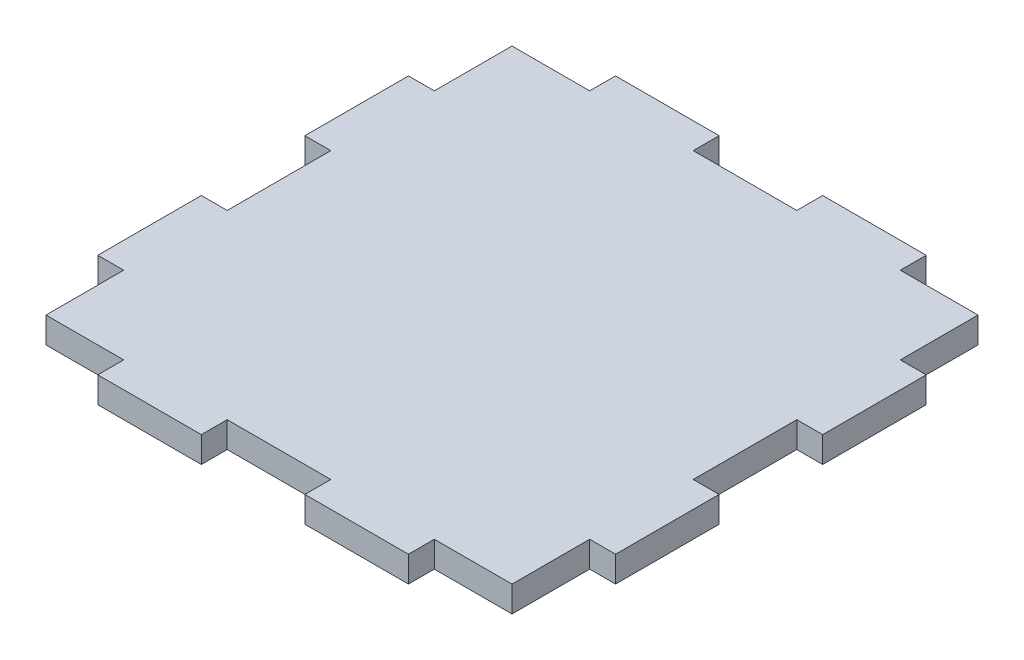
from build123d import *

# Parameters (mm, degrees)
SKETCH1_W           = 190.5
SKETCH1_H           = 190.5
BOSS_EXTRUDE1_DEPTH = 9.525
SKETCH2_W           = 9.525
SKETCH2_H           = 38.1
CUT_EXTRUDE1_DEPTH  = 9.525
SKETCH3_W           = 9.525
SKETCH3_H           = 38.1
CUT_EXTRUDE2_DEPTH  = 9.525
SKETCH4_W           = 9.525
SKETCH4_H           = 38.1
CUT_EXTRUDE3_DEPTH  = 9.525
SKETCH5_W           = 9.525
SKETCH5_H           = 38.1
CUT_EXTRUDE4_DEPTH  = 9.525
SKETCH6_W           = 9.525
SKETCH6_H           = 38.1
CUT_EXTRUDE5_DEPTH  = 9.525
SKETCH7_W           = 9.525
SKETCH7_H           = 38.1
CUT_EXTRUDE6_DEPTH  = 9.525
SKETCH8_W           = 28.575
SKETCH8_H           = 9.525
CUT_EXTRUDE7_DEPTH  = 9.525
SKETCH9_W           = 38.1
SKETCH9_H           = 9.525
CUT_EXTRUDE8_DEPTH  = 9.525
SKETCH10_W          = 28.575
SKETCH10_H          = 9.525
CUT_EXTRUDE9_DEPTH  = 9.525
SKETCH11_W          = 28.575
SKETCH11_H          = 9.525
CUT_EXTRUDE11_DEPTH = 9.525
SKETCH12_W          = 38.1
SKETCH12_H          = 9.525
CUT_EXTRUDE12_DEPTH = 9.525
SKETCH14_W          = 28.575
SKETCH14_H          = 9.525
CUT_EXTRUDE13_DEPTH = 9.525


with BuildPart() as part:
    # Sketch1 → Boss-Extrude1 (new body)
    with BuildSketch(Plane(origin=(0, 0, 0), x_dir=(1, 0, 0), z_dir=(0, 1, 0))):
        with Locations((-91.022160665, 92.07132964)):
            Rectangle(SKETCH1_W, SKETCH1_H)
    extrude(amount=BOSS_EXTRUDE1_DEPTH)

    # Sketch2 → Cut-Extrude1 (cut)
    with BuildSketch(Plane(origin=(0, 9.525, 0), x_dir=(1, 0, 0), z_dir=(0, 1, 0))):
        with Locations((-0.534660665, 15.87132964)):
            Rectangle(SKETCH2_W, SKETCH2_H)
    extrude(amount=-CUT_EXTRUDE1_DEPTH, mode=Mode.SUBTRACT)

    # Sketch3 → Cut-Extrude2 (cut)
    with BuildSketch(Plane(origin=(0, 9.525, 0), x_dir=(1, 0, 0), z_dir=(0, 1, 0))):
        with Locations((-0.534660665, 92.07132964)):
            Rectangle(SKETCH3_W, SKETCH3_H)
    extrude(amount=-CUT_EXTRUDE2_DEPTH, mode=Mode.SUBTRACT)

    # Sketch4 → Cut-Extrude3 (cut)
    with BuildSketch(Plane(origin=(0, 9.525, 0), x_dir=(1, 0, 0), z_dir=(0, 1, 0))):
        with Locations((-0.534660665, 168.27132964)):
            Rectangle(SKETCH4_W, SKETCH4_H)
    extrude(amount=-CUT_EXTRUDE3_DEPTH, mode=Mode.SUBTRACT)

    # Sketch5 → Cut-Extrude4 (cut)
    with BuildSketch(Plane.XZ):
        with Locations((-181.509660665, -15.87132964)):
            Rectangle(SKETCH5_W, SKETCH5_H)
    extrude(amount=-CUT_EXTRUDE4_DEPTH, mode=Mode.SUBTRACT)

    # Sketch6 → Cut-Extrude5 (cut)
    with BuildSketch(Plane.XZ):
        with Locations((-181.509660665, -92.07132964)):
            Rectangle(SKETCH6_W, SKETCH6_H)
    extrude(amount=-CUT_EXTRUDE5_DEPTH, mode=Mode.SUBTRACT)

    # Sketch7 → Cut-Extrude6 (cut)
    with BuildSketch(Plane.XZ):
        with Locations((-181.509660665, -168.27132964)):
            Rectangle(SKETCH7_W, SKETCH7_H)
    extrude(amount=-CUT_EXTRUDE6_DEPTH, mode=Mode.SUBTRACT)

    # Sketch8 → Cut-Extrude7 (cut)
    with BuildSketch(Plane.XZ):
        with Locations((-19.584660665, -182.55882964)):
            Rectangle(SKETCH8_W, SKETCH8_H)
    extrude(amount=-CUT_EXTRUDE7_DEPTH, mode=Mode.SUBTRACT)

    # Sketch9 → Cut-Extrude8 (cut)
    with BuildSketch(Plane.XZ):
        with Locations((-91.022160665, -182.55882964)):
            Rectangle(SKETCH9_W, SKETCH9_H)
    extrude(amount=-CUT_EXTRUDE8_DEPTH, mode=Mode.SUBTRACT)

    # Sketch10 → Cut-Extrude9 (cut)
    with BuildSketch(Plane.XZ):
        with Locations((-162.459660665, -182.55882964)):
            Rectangle(SKETCH10_W, SKETCH10_H)
    extrude(amount=-CUT_EXTRUDE9_DEPTH, mode=Mode.SUBTRACT)

    # Sketch11 → Cut-Extrude11 (cut)
    with BuildSketch(Plane(origin=(0, 0, 0), x_dir=(-1, 0, 0), z_dir=(0, -1, 0))):
        with Locations((162.459660665, 1.58382964)):
            Rectangle(SKETCH11_W, SKETCH11_H)
    extrude(amount=-CUT_EXTRUDE11_DEPTH, mode=Mode.SUBTRACT)

    # Sketch12 → Cut-Extrude12 (cut)
    with BuildSketch(Plane.XZ):
        with Locations((-91.022160665, -1.58382964)):
            Rectangle(SKETCH12_W, SKETCH12_H)
    extrude(amount=-CUT_EXTRUDE12_DEPTH, mode=Mode.SUBTRACT)

    # Sketch14 → Cut-Extrude13 (cut)
    with BuildSketch(Plane(origin=(0, 0, 0), x_dir=(-1, 0, 0), z_dir=(0, -1, 0))):
        with Locations((19.584660665, 1.58382964)):
            Rectangle(SKETCH14_W, SKETCH14_H)
    extrude(amount=-CUT_EXTRUDE13_DEPTH, mode=Mode.SUBTRACT)


solid = part.part
